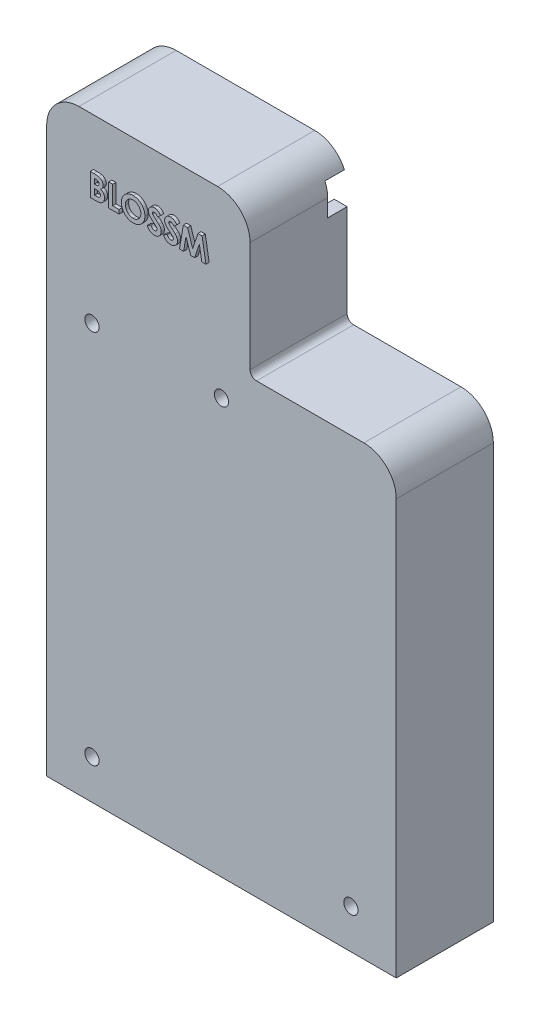
from build123d import *

# Parameters (mm, degrees)
BOSS_EXTRUDE1_DEPTH = 15
BOSS_EXTRUDE2_DEPTH = 15
CUT_EXTRUDE1_DEPTH  = 14
SKETCH8_W           = 6.699223296
SKETCH8_H           = 4.721357371
SKETCH8_W_2         = 8.228893272
CUT_EXTRUDE7_DEPTH  = 3
BOSS_EXTRUDE4_REACH = 1406.346
SKETCH10_R          = 2.1
SKETCH10_R_2        = 1.1
SKETCH11_R          = 1.1
CUT_EXTRUDE8_DEPTH  = 15
BOSS_EXTRUDE5_DEPTH = 0.5


with BuildPart() as part:
    # Sketch3 → Boss-Extrude1 (new body)
    with BuildSketch(Plane.XY.offset(1303.472903018)):
        with BuildLine():
            Line((839.650097305, 1097.589789038), (839.650097371, 1033.49652121))
            Line((839.650097371, 1033.49652121), (785.650097371, 1033.49652121))
            Line((785.650097371, 1033.49652121), (785.650097438, 1120.589789038))
            ThreePointArc((785.650097438, 1120.589789038), (787.114883847, 1124.124637961), (790.64973277, 1125.58942437))
            Line((790.64973277, 1125.58942437), (812.066461973, 1125.58942437))
            ThreePointArc((812.066461973, 1125.58942437), (815.601310896, 1124.124637961), (817.066097305, 1120.589789038))
            Line((817.066097305, 1120.589789038), (817.066097305, 1103.589789038))
            ThreePointArc((817.066097305, 1103.589789038), (817.35931084, 1102.882637905), (818.066461973, 1102.58942437))
            Line((818.066461973, 1102.58942437), (834.650461973, 1102.58942437))
            ThreePointArc((834.650461973, 1102.58942437), (838.185310896, 1101.124637961), (839.650097305, 1097.589789038))
        make_face()
        with BuildLine():
            Line((787.650097371, 1035.49652121), (787.650097371, 1120.589424436))
            ThreePointArc((787.650097371, 1120.589424436), (788.529097371, 1122.710424436), (790.650097371, 1123.589424436))
            Line((790.650097371, 1123.589424436), (812.066097371, 1123.589424436))
            ThreePointArc((812.066097371, 1123.589424436), (814.187097371, 1122.710424436), (815.066097371, 1120.589424436))
            Line((815.066097371, 1120.589424436), (815.066097371, 1103.589424436))
            ThreePointArc((815.066097371, 1103.589424436), (815.945097371, 1101.468424436), (818.066097371, 1100.589424436))
            Line((818.066097371, 1100.589424436), (834.650097371, 1100.589424436))
            ThreePointArc((834.650097371, 1100.589424436), (836.771097371, 1099.710424436), (837.650097371, 1097.589424436))
            Line((837.650097371, 1097.589424436), (837.650097371, 1035.49652121))
            Line((837.650097371, 1035.49652121), (787.650097371, 1035.49652121))
        make_face(mode=Mode.SUBTRACT)
    extrude(amount=BOSS_EXTRUDE1_DEPTH)

    # Sketch6 → Boss-Extrude2 (add)
    with BuildSketch(Plane.XY.offset(1303.472903018)):
        with BuildLine():
            Line((787.650097371, 1035.49652121), (837.650097371, 1035.49652121))
            Line((837.650097371, 1035.49652121), (837.650097371, 1097.589424436))
            ThreePointArc((837.650097371, 1097.589424436), (836.771097371, 1099.710424436), (834.650097371, 1100.589424436))
            Line((834.650097371, 1100.589424436), (818.066097371, 1100.589424436))
            ThreePointArc((818.066097371, 1100.589424436), (815.945097371, 1101.468424436), (815.066097371, 1103.589424436))
            Line((815.066097371, 1103.589424436), (815.066097371, 1120.589424436))
            ThreePointArc((815.066097371, 1120.589424436), (814.187097371, 1122.710424436), (812.066097371, 1123.589424436))
            Line((812.066097371, 1123.589424436), (790.650097371, 1123.589424436))
            ThreePointArc((790.650097371, 1123.589424436), (788.529097371, 1122.710424436), (787.650097371, 1120.589424436))
            Line((787.650097371, 1120.589424436), (787.650097371, 1035.49652121))
        make_face()
    extrude(amount=BOSS_EXTRUDE2_DEPTH)

    # Sketch6<2> → Cut-Extrude1 (cut)
    with BuildSketch(Plane.XY.offset(1303.472903018)):
        with BuildLine():
            Line((787.650097371, 1035.49652121), (837.650097371, 1035.49652121))
            Line((837.650097371, 1035.49652121), (837.650097371, 1097.589424436))
            ThreePointArc((837.650097371, 1097.589424436), (836.771097371, 1099.710424436), (834.650097371, 1100.589424436))
            Line((834.650097371, 1100.589424436), (818.066097371, 1100.589424436))
            ThreePointArc((818.066097371, 1100.589424436), (815.945097371, 1101.468424436), (815.066097371, 1103.589424436))
            Line((815.066097371, 1103.589424436), (815.066097371, 1120.589424436))
            ThreePointArc((815.066097371, 1120.589424436), (814.187097371, 1122.710424436), (812.066097371, 1123.589424436))
            Line((812.066097371, 1123.589424436), (790.650097371, 1123.589424436))
            ThreePointArc((790.650097371, 1123.589424436), (788.529097371, 1122.710424436), (787.650097371, 1120.589424436))
            Line((787.650097371, 1120.589424436), (787.650097371, 1035.49652121))
        make_face()
    extrude(amount=CUT_EXTRUDE1_DEPTH, mode=Mode.SUBTRACT)

    # Sketch8 → Cut-Extrude7 (cut)
    with BuildSketch(Plane.XY.offset(1303.472903018)):
        with Locations((788.177093813, 1120.255926572)):
            Rectangle(SKETCH8_W, SKETCH8_H)
        with Locations((813.958809837, 1120.255926572)):
            Rectangle(SKETCH8_W_2, SKETCH8_H)
    extrude(amount=CUT_EXTRUDE7_DEPTH, mode=Mode.SUBTRACT)

    # Sketch10 → Boss-Extrude4 (add, up to next)
    with BuildSketch(Plane.XY.offset(1303.472903018), mode=Mode.PRIVATE) as boss_extrude4_sk1:
        with Locations((792.650097371, 1039.589424436)):
            Circle(SKETCH10_R)
        with Locations((792.650097371, 1039.589424436)):
            Circle(SKETCH10_R_2, mode=Mode.SUBTRACT)
    boss_extrude4_tool1 = extrude(boss_extrude4_sk1.sketch, amount=BOSS_EXTRUDE4_REACH, mode=Mode.PRIVATE) - part.part
    # Sketch10 → Boss-Extrude4 (add, up to next)
    with BuildSketch(Plane.XY.offset(1303.472903018), mode=Mode.PRIVATE) as boss_extrude4_sk2:
        with Locations((832.650097371, 1039.589424436)):
            Circle(SKETCH10_R)
        with Locations((832.650097371, 1039.589424436)):
            Circle(SKETCH10_R_2, mode=Mode.SUBTRACT)
    boss_extrude4_tool2 = extrude(boss_extrude4_sk2.sketch, amount=BOSS_EXTRUDE4_REACH, mode=Mode.PRIVATE) - part.part
    # Sketch10 → Boss-Extrude4 (add, up to next)
    with BuildSketch(Plane.XY.offset(1303.472903018), mode=Mode.PRIVATE) as boss_extrude4_sk3:
        with Locations((812.650097371, 1097.589424436)):
            Circle(SKETCH10_R)
        with Locations((812.650097371, 1097.589424436)):
            Circle(SKETCH10_R_2, mode=Mode.SUBTRACT)
    boss_extrude4_tool3 = extrude(boss_extrude4_sk3.sketch, amount=BOSS_EXTRUDE4_REACH, mode=Mode.PRIVATE) - part.part
    # Sketch10 → Boss-Extrude4 (add, up to next)
    with BuildSketch(Plane.XY.offset(1303.472903018), mode=Mode.PRIVATE) as boss_extrude4_sk4:
        with Locations((792.650097371, 1097.589424436)):
            Circle(SKETCH10_R)
        with Locations((792.650097371, 1097.589424436)):
            Circle(SKETCH10_R_2, mode=Mode.SUBTRACT)
    boss_extrude4_tool4 = extrude(boss_extrude4_sk4.sketch, amount=BOSS_EXTRUDE4_REACH, mode=Mode.PRIVATE) - part.part
    add(boss_extrude4_tool1.solids().sort_by_distance((790.609494, 1039.589424, 1303.472903))[0])
    add(boss_extrude4_tool2.solids().sort_by_distance((830.609494, 1039.589424, 1303.472903))[0])
    add(boss_extrude4_tool3.solids().sort_by_distance((810.609494, 1097.589424, 1303.472903))[0])
    add(boss_extrude4_tool4.solids().sort_by_distance((790.609494, 1097.589424, 1303.472903))[0])

    # Sketch11 → Cut-Extrude8 (cut)
    with BuildSketch(Plane.XY.offset(1303.472903018)):
        with Locations((792.650097371, 1097.589424436)):
            Circle(SKETCH11_R)
        with Locations((812.650097371, 1097.589424436)):
            Circle(SKETCH11_R)
        with Locations((792.650097371, 1039.589424436)):
            Circle(SKETCH11_R)
        with Locations((832.650097371, 1039.589424436)):
            Circle(SKETCH11_R)
    extrude(amount=CUT_EXTRUDE8_DEPTH, mode=Mode.SUBTRACT)

    # Sketch12 → Boss-Extrude5 (add)
    # profile 1 of 12: a face of its own
    with BuildSketch(Plane.XY.offset(1318.472903018)):
        with BuildLine():
            Line((0.448717949, 3.5), (1.131610577, 3.5))
            add(Edge.make_bspline(
                [(1.131610577, 3.5), (1.165039055, 3.49982425), (1.229831765, 3.499483602), (1.324051207, 3.49420047), (1.412300018, 3.486996801), (1.49460379, 3.475566708), (1.570924493, 3.461774931), (1.64149213, 3.445073115), (1.706082302, 3.425046501), (1.783195039, 3.39320022), (1.871115699, 3.345877051), (1.966314092, 3.275948486), (2.047718332, 3.190416023), (2.117904649, 3.093933368), (2.173705768, 2.987797596), (2.214075066, 2.874538407), (2.239632941, 2.755616665), (2.242261375, 2.673973487), (2.243589744, 2.63271234)],
                knots=[0, 0, 0, 0, 1.001505555, 1.941167018, 2.826882275, 3.653841531, 4.429895133, 5.150066043, 5.825578002, 6.45369114, 7.647487171, 8.808567382, 9.977351308, 11.170798116, 12.373658725, 13.556498008, 14.765093433, 16, 16, 16, 16], degree=3))
            add(Edge.make_bspline(
                [(2.243589744, 2.63271234), (2.242496525, 2.594059784), (2.240348248, 2.518103867), (2.219805488, 2.407009758), (2.18764482, 2.301258539), (2.142939571, 2.201236154), (2.084837575, 2.10920254), (2.015979256, 2.024415274), (1.932902454, 1.950464217), (1.870659214, 1.909121315), (1.839042468, 1.888120994)],
                knots=[0, 0, 0, 0, 1.044552857, 2.05264487, 3.044412934, 4.028983338, 5.005914585, 5.980388656, 6.974128949, 8, 8, 8, 8], degree=3))
            add(Edge.make_bspline(
                [(1.839042468, 1.888120994), (1.878802896, 1.872855995), (1.954874443, 1.84365027), (2.059560455, 1.792014806), (2.1497553, 1.735852696), (2.226152446, 1.674520846), (2.291490101, 1.608412035), (2.348543043, 1.536556921), (2.397224417, 1.458018163), (2.438937341, 1.373614627), (2.471486097, 1.284208159), (2.495862001, 1.190637383), (2.50982945, 1.093237828), (2.511817091, 1.026952448), (2.512820513, 0.993489583)],
                knots=[0, 0, 0, 0, 1.27268992, 2.434971085, 3.483601985, 4.442670788, 5.356604649, 6.2567628, 7.179492994, 8.113709626, 9.066344395, 10.018646069, 10.999752585, 12, 12, 12, 12], degree=3))
            add(Edge.make_bspline(
                [(2.512820513, 0.993489583), (2.511843667, 0.959322711), (2.509921695, 0.892098433), (2.495741723, 0.793343299), (2.471732616, 0.698968352), (2.43866147, 0.608363169), (2.395499155, 0.521703035), (2.342971191, 0.438889771), (2.280339627, 0.36075544), (2.210276758, 0.286431817), (2.131014613, 0.21960403), (2.045498858, 0.160088323), (1.952652538, 0.111142261), (1.854000544, 0.070026239), (1.748436228, 0.038619041), (1.63643362, 0.016646467), (1.518089319, 0.00184143), (1.436879567, 0.000624225), (1.395232372, 0)],
                knots=[0, 0, 0, 0, 0.978564426, 1.925352924, 2.850884081, 3.763762016, 4.682927383, 5.618979971, 6.567305752, 7.547517671, 8.540179244, 9.531824382, 10.526200242, 11.540722885, 12.589160233, 13.674978461, 14.80764778, 16, 16, 16, 16], degree=3))
            Line((1.395232372, 0), (0.448717949, 0))
            Line((0.448717949, 0), (0.448717949, 3.5))
        make_face()
        with BuildLine():
            Line((0.762820513, 3.141025641), (0.762820513, 2.019230769))
            Line((0.762820513, 2.019230769), (0.973858173, 2.019230769))
            add(Edge.make_bspline(
                [(0.973858173, 2.019230769), (1.004706968, 2.019630692), (1.064313128, 2.020403425), (1.150633024, 2.022616942), (1.230758042, 2.028814985), (1.304549876, 2.035011248), (1.371892319, 2.045085835), (1.432636181, 2.057077958), (1.487734778, 2.069760863), (1.551274323, 2.09133035), (1.623347272, 2.123208025), (1.700180376, 2.172679861), (1.767914846, 2.231604215), (1.825112033, 2.299595176), (1.871923504, 2.374461362), (1.904437219, 2.455008243), (1.926484503, 2.539228375), (1.928476035, 2.597046627), (1.929487179, 2.626402244)],
                knots=[0, 0, 0, 0, 1.156816544, 2.235205308, 3.236616184, 4.169592532, 5.011045266, 5.787822928, 6.49130361, 7.128639758, 8.301311294, 9.436451833, 10.541879658, 11.654887649, 12.756523258, 13.837046038, 14.901820046, 16, 16, 16, 16], degree=3))
            add(Edge.make_bspline(
                [(1.929487179, 2.626402244), (1.928960999, 2.645828015), (1.927928839, 2.683933787), (1.919475537, 2.739483141), (1.905107962, 2.791726894), (1.886653669, 2.841381004), (1.86086498, 2.886892854), (1.830501517, 2.92983605), (1.793815827, 2.968748169), (1.752058514, 3.005117667), (1.704049891, 3.037362195), (1.649818599, 3.065602958), (1.588630922, 3.088343735), (1.521518067, 3.108259887), (1.44744698, 3.122248181), (1.367272427, 3.133901569), (1.280337708, 3.139834311), (1.220192605, 3.140619673), (1.189102564, 3.141025641)],
                knots=[0, 0, 0, 0, 0.91205012, 1.789085906, 2.630437955, 3.453916878, 4.269457761, 5.079663411, 5.91843418, 6.774407191, 7.675494373, 8.627863946, 9.638891023, 10.736472738, 11.911756761, 13.175263542, 14.539845004, 16, 16, 16, 16], degree=3))
            Line((1.189102564, 3.141025641), (0.762820513, 3.141025641))
        make_face(mode=Mode.SUBTRACT)
        with BuildLine():
            Line((0.762820513, 1.66025641), (0.762820513, 0.358974359))
            Line((0.762820513, 0.358974359), (1.210136218, 0.358974359))
            add(Edge.make_bspline(
                [(1.210136218, 0.358974359), (1.242155144, 0.359358106), (1.303867402, 0.360097729), (1.392968633, 0.362512283), (1.475551736, 0.368004559), (1.551239872, 0.376650409), (1.620850325, 0.386028858), (1.683548028, 0.398640139), (1.739841221, 0.413089099), (1.805115529, 0.435423272), (1.878619037, 0.470119743), (1.957829894, 0.522433969), (2.028256112, 0.584757277), (2.088061371, 0.656888191), (2.13707436, 0.735319518), (2.172729815, 0.818464868), (2.194720671, 0.904950395), (2.197382841, 0.963917108), (2.198717949, 0.993489583)],
                knots=[0, 0, 0, 0, 1.160039823, 2.235823828, 3.228722157, 4.157150951, 4.99529583, 5.772374946, 6.472645482, 7.099169577, 8.269452708, 9.405989375, 10.527446681, 11.663510218, 12.788923519, 13.866172445, 14.929861265, 16, 16, 16, 16], degree=3))
            add(Edge.make_bspline(
                [(2.198717949, 0.993489583), (2.198441844, 1.011982924), (2.197894089, 1.048671306), (2.189633474, 1.102587125), (2.177619605, 1.154812998), (2.162088171, 1.205490739), (2.139468704, 1.253704115), (2.113062159, 1.300406674), (2.082100757, 1.345660154), (2.033856591, 1.402872407), (1.963684607, 1.46878942), (1.863977831, 1.533326923), (1.750605533, 1.58537473), (1.66837804, 1.607474206), (1.625901442, 1.618890224)],
                knots=[0, 0, 0, 0, 0.723448775, 1.435228256, 2.130040452, 2.821711965, 3.505591119, 4.210454504, 4.921174351, 5.648778258, 7.137944449, 8.670945889, 10.280296675, 12, 12, 12, 12], degree=3))
            add(Edge.make_bspline(
                [(1.625901442, 1.618890224), (1.608872346, 1.622345308), (1.571949754, 1.629836643), (1.511742174, 1.637744346), (1.443006305, 1.644789406), (1.365583428, 1.650000564), (1.279375586, 1.655387107), (1.184198668, 1.657481929), (1.080441353, 1.659981189), (1.008448981, 1.660162323), (0.971053686, 1.66025641)],
                knots=[0, 0, 0, 0, 0.634451884, 1.375622551, 2.216452059, 3.157844607, 4.20941857, 5.370758133, 6.634282058, 8, 8, 8, 8], degree=3))
            Line((0.971053686, 1.66025641), (0.762820513, 1.66025641))
        make_face(mode=Mode.SUBTRACT)
    # profile 2 of 12: a face of its own
    with BuildSketch(Plane.XY.offset(1318.472903018)):
        Polygon((3.230769231, 3.5), (3.544871795, 3.5), (3.544871795, 0.358974359), (4.891025641, 0.358974359), (4.891025641, 0), (3.230769231, 0), align=None)
    # profile 3 of 12: a face of its own
    with BuildSketch(Plane.XY.offset(1318.472903018)):
        with BuildLine():
            add(Edge.make_bspline(
                [(7.112179487, 3.58974359), (7.176987593, 3.58810211), (7.30427606, 3.584878109), (7.491350958, 3.560199006), (7.669946053, 3.517503616), (7.841516192, 3.460640633), (8.004009168, 3.384786248), (8.158648061, 3.2931011), (8.305064935, 3.184624641), (8.441286316, 3.060195414), (8.565943267, 2.92481196), (8.675769153, 2.78033405), (8.767811447, 2.627635248), (8.843397234, 2.467174417), (8.902695843, 2.299314449), (8.943614887, 2.123160446), (8.969753037, 1.939853756), (8.972808815, 1.814826892), (8.974358974, 1.751402244)],
                knots=[0, 0, 0, 0, 1.065120563, 2.091984664, 3.0946048, 4.079830382, 5.057816894, 6.036188127, 7.030412546, 8.04752943, 9.064399622, 10.05169764, 11.02544977, 11.989514704, 12.962713494, 13.945757189, 14.957906945, 16, 16, 16, 16], degree=3))
            add(Edge.make_bspline(
                [(8.974358974, 1.751402244), (8.972809042, 1.688444797), (8.969753945, 1.564348377), (8.943585168, 1.382204933), (8.902544168, 1.207114236), (8.843947902, 1.039368583), (8.768722423, 0.87879102), (8.676067252, 0.725804066), (8.566926041, 0.580357567), (8.44271919, 0.444044902), (8.307318148, 0.319047431), (8.162087881, 0.210128556), (8.010294561, 0.116404431), (7.849984853, 0.041620757), (7.683284816, -0.018151163), (7.508702493, -0.058903793), (7.327055939, -0.085190837), (7.203184936, -0.088209353), (7.140224359, -0.08974359)],
                knots=[0, 0, 0, 0, 1.043624062, 2.057103931, 3.04512605, 4.022047818, 4.998200453, 5.980619268, 6.982898556, 8.009068085, 9.034988726, 10.034168286, 11.015286542, 11.987931943, 12.962482838, 13.94673481, 14.956375938, 16, 16, 16, 16], degree=3))
            add(Edge.make_bspline(
                [(7.140224359, -0.08974359), (7.07680004, -0.088194203), (6.951773824, -0.085139949), (6.768236789, -0.058958544), (6.591959045, -0.01801724), (6.423444694, 0.040492196), (6.262599764, 0.116109427), (6.109109681, 0.208313806), (5.963590534, 0.317720947), (5.827248788, 0.441887521), (5.702499589, 0.577059073), (5.593740214, 0.721893329), (5.5015151, 0.873548785), (5.426151768, 1.032446309), (5.366487309, 1.197817752), (5.32578249, 1.370766229), (5.299446538, 1.550305735), (5.296411692, 1.672548634), (5.294871795, 1.734575321)],
                knots=[0, 0, 0, 0, 1.053102029, 2.075944431, 3.073151272, 4.055350789, 5.033113405, 6.020478099, 7.024410459, 8.052272461, 9.079885166, 10.07527673, 11.055994387, 12.023226415, 12.992069828, 13.970394897, 14.97016774, 16, 16, 16, 16], degree=3))
            add(Edge.make_bspline(
                [(5.294871795, 1.734575321), (5.29540643, 1.77620799), (5.296468957, 1.858948113), (5.309260649, 1.981814713), (5.32782235, 2.102705371), (5.354424263, 2.221276319), (5.38921593, 2.337237304), (5.430267957, 2.451388067), (5.480407803, 2.56257179), (5.537088451, 2.671315182), (5.600350259, 2.775923088), (5.670226008, 2.874802671), (5.744261377, 2.968783668), (5.82542477, 3.055430672), (5.911041215, 3.137264328), (6.002499594, 3.213027045), (6.099241838, 3.283401996), (6.201684218, 3.346822337), (6.307302493, 3.404181472), (6.41617927, 3.453403323), (6.526835842, 3.495649384), (6.63979049, 3.529890209), (6.754743262, 3.556922245), (6.871945046, 3.575329599), (6.991302473, 3.588153917), (7.071713792, 3.589211419), (7.112179487, 3.58974359)],
                knots=[0, 0, 0, 0, 1.037015668, 2.060948919, 3.074880161, 4.083647147, 5.086022904, 6.090072063, 7.104153813, 8.122640571, 9.144368836, 10.147691507, 11.138137339, 12.123020368, 13.103399296, 14.087645067, 15.080126199, 16.082011238, 17.087798457, 18.072939717, 19.057185487, 20.037253025, 21.01195951, 21.997135196, 22.992090687, 24, 24, 24, 24], degree=3))
        make_face()
        with BuildLine():
            add(Edge.make_bspline(
                [(7.127604167, 3.230769231), (7.094389533, 3.230364341), (7.0282778, 3.229558431), (6.929993264, 3.218942715), (6.83300133, 3.203812826), (6.737281968, 3.182231305), (6.643235679, 3.152827253), (6.549985837, 3.118986345), (6.458382784, 3.077765254), (6.368728926, 3.03119255), (6.281813851, 2.979643629), (6.199801149, 2.922671862), (6.122478505, 2.861613307), (6.050035238, 2.79632547), (5.982684066, 2.726475868), (5.919099365, 2.653123432), (5.861829783, 2.574171541), (5.809344206, 2.491761134), (5.762376366, 2.405999553), (5.720611011, 2.317789691), (5.686447003, 2.226412004), (5.658584626, 2.132857846), (5.635484815, 2.037275387), (5.620850891, 1.938939538), (5.610118532, 1.838344426), (5.609358686, 1.770362572), (5.608974359, 1.735977564)],
                knots=[0, 0, 0, 0, 1.008559885, 2.007477868, 2.99961109, 3.989939068, 4.984837346, 5.991145699, 7.001802488, 8.033829008, 9.059044045, 10.069351652, 11.065060232, 12.050310815, 13.029377138, 14.011219647, 14.996725999, 15.989392538, 16.977580475, 17.965360261, 18.951710183, 19.937753436, 20.929683414, 21.935841486, 22.955955122, 24, 24, 24, 24], degree=3))
            add(Edge.make_bspline(
                [(5.608974359, 1.735977564), (5.610249221, 1.685415343), (5.612757269, 1.585943813), (5.634714839, 1.440175669), (5.668536813, 1.300087383), (5.71839418, 1.166445474), (5.780744794, 1.038101191), (5.857771685, 0.916193086), (5.94903077, 0.800688212), (6.052694297, 0.692392943), (6.166017004, 0.593547138), (6.286349733, 0.50678373), (6.412403341, 0.43337348), (6.544506544, 0.373568408), (6.681954083, 0.32617867), (6.825631634, 0.293700039), (6.974582093, 0.272324583), (7.076112748, 0.270271827), (7.127604167, 0.269230769)],
                knots=[0, 0, 0, 0, 1.032063989, 2.030389145, 3.003944642, 3.970395727, 4.937377036, 5.913328081, 6.909231446, 7.93887556, 8.970685674, 9.976071282, 10.964166581, 11.944589148, 12.933237628, 13.927779006, 14.949070134, 16, 16, 16, 16], degree=3))
            add(Edge.make_bspline(
                [(7.127604167, 0.269230769), (7.162213668, 0.269706274), (7.230854705, 0.270649342), (7.332950227, 0.280148018), (7.433206439, 0.295379888), (7.531482719, 0.317310543), (7.62766753, 0.34475775), (7.722162333, 0.377365478), (7.813960623, 0.418046682), (7.904220461, 0.462994633), (7.990616703, 0.514234791), (8.073092235, 0.56927294), (8.149568215, 0.630241561), (8.221957286, 0.694559374), (8.289584975, 0.763523221), (8.35199396, 0.837043443), (8.408974092, 0.9155841), (8.461439738, 0.997869506), (8.508243001, 1.083865759), (8.5490221, 1.172395437), (8.583618216, 1.263240546), (8.611546721, 1.356532118), (8.633432183, 1.452092966), (8.648512103, 1.550051045), (8.659060541, 1.650210387), (8.659855618, 1.717954243), (8.66025641, 1.752103365)],
                knots=[0, 0, 0, 0, 1.047197238, 2.076906641, 3.100256066, 4.114471768, 5.12198147, 6.126382909, 7.136867548, 8.15857795, 9.17633901, 10.174870724, 11.156907918, 12.133735059, 13.104061851, 14.077631395, 15.04955518, 16.038496417, 17.029181396, 18.010275684, 18.986308667, 19.968651475, 20.955262928, 21.950658345, 22.966943676, 24, 24, 24, 24], degree=3))
            add(Edge.make_bspline(
                [(8.66025641, 1.752103365), (8.659855297, 1.78601887), (8.659059616, 1.85329652), (8.648517141, 1.952757338), (8.633416251, 2.05001055), (8.611653543, 2.144674353), (8.583603389, 2.236772878), (8.549016059, 2.326219625), (8.508230759, 2.413347821), (8.461422535, 2.497942118), (8.408806711, 2.579116855), (8.351312468, 2.656719268), (8.28794712, 2.729292009), (8.220521095, 2.798626703), (8.14735021, 2.863244593), (8.068765916, 2.923167114), (7.985722238, 2.979840388), (7.897795002, 3.03096595), (7.807051049, 3.078180182), (7.713937091, 3.118631186), (7.619507991, 3.153003305), (7.524003879, 3.18232027), (7.4266209, 3.2037283), (7.328017072, 3.21895635), (7.228328813, 3.229554736), (7.161285593, 3.230363114), (7.127604167, 3.230769231)],
                knots=[0, 0, 0, 0, 1.02996197, 2.043119294, 3.035359645, 4.018872909, 4.991431989, 5.957985074, 6.929999688, 7.912076566, 8.892894881, 9.867085534, 10.843653904, 11.817741046, 12.803660682, 13.806313499, 14.818574707, 15.856120519, 16.894564902, 17.924820532, 18.937903209, 19.946497019, 20.957711757, 21.963978472, 22.977135795, 24, 24, 24, 24], degree=3))
        make_face(mode=Mode.SUBTRACT)
    # profile 4 of 12: a face of its own
    with BuildSketch(Plane.XY.offset(1318.472903018)):
        with BuildLine():
            Line((9.333333333, 0.675180288), (9.629206731, 0.852564103))
            add(Edge.make_bspline(
                [(9.629206731, 0.852564103), (9.656724968, 0.806499718), (9.709448849, 0.718242134), (9.797400208, 0.598984093), (9.888533119, 0.497621937), (9.983522453, 0.414745329), (10.081788401, 0.349496442), (10.183972454, 0.303294211), (10.289730265, 0.274478235), (10.361704087, 0.270978149), (10.397636218, 0.269230769)],
                knots=[0, 0, 0, 0, 1.272034388, 2.437168799, 3.508375237, 4.49857839, 5.41946034, 6.295179144, 7.148887113, 8, 8, 8, 8], degree=3))
            add(Edge.make_bspline(
                [(10.397636218, 0.269230769), (10.428323078, 0.270085442), (10.489159852, 0.271779832), (10.578722094, 0.288060634), (10.665703897, 0.313072763), (10.748312534, 0.348893694), (10.825408149, 0.39223218), (10.893014844, 0.444578358), (10.951460958, 0.503184563), (10.999270072, 0.568567218), (11.035950107, 0.638884367), (11.064142176, 0.711060318), (11.079787249, 0.786228886), (11.082144003, 0.836839349), (11.083333333, 0.862379808)],
                knots=[0, 0, 0, 0, 1.095163259, 2.171163733, 3.241058638, 4.321873601, 5.38011039, 6.391990106, 7.366004449, 8.327778327, 9.272591725, 10.192022065, 11.087607919, 12, 12, 12, 12], degree=3))
            add(Edge.make_bspline(
                [(11.083333333, 0.862379808), (11.081859023, 0.891520657), (11.078861964, 0.950759747), (11.053530484, 1.0381594), (11.013681238, 1.12465197), (10.976918594, 1.178153235), (10.957832532, 1.205929487)],
                knots=[0, 0, 0, 0, 0.938893495, 1.908633276, 2.914225137, 4, 4, 4, 4], degree=3))
            add(Edge.make_bspline(
                [(10.957832532, 1.205929487), (10.942161918, 1.225976311), (10.909263424, 1.268062109), (10.852705911, 1.330707345), (10.786339797, 1.395325764), (10.712436242, 1.464384821), (10.628303153, 1.534672617), (10.536575639, 1.609540895), (10.43491178, 1.686142472), (10.363612283, 1.737515038), (10.326822917, 1.764022436)],
                knots=[0, 0, 0, 0, 0.722233717, 1.516239348, 2.393582979, 3.351407094, 4.387010283, 5.505090956, 6.712668013, 8, 8, 8, 8], degree=3))
            add(Edge.make_bspline(
                [(10.326822917, 1.764022436), (10.28999892, 1.790251024), (10.219594244, 1.840398086), (10.121135662, 1.91482237), (10.033091199, 1.982866239), (9.955852182, 2.045170251), (9.889452585, 2.101742856), (9.833369174, 2.152040795), (9.789030617, 2.197424356), (9.764375036, 2.226865698), (9.753305288, 2.240084135)],
                knots=[0, 0, 0, 0, 1.452282411, 2.77665338, 3.964542531, 5.026858415, 5.96415736, 6.766646006, 7.446254459, 8, 8, 8, 8], degree=3))
            add(Edge.make_bspline(
                [(9.753305288, 2.240084135), (9.737832743, 2.260685171), (9.707403907, 2.301199875), (9.667237901, 2.364524733), (9.633098738, 2.429347998), (9.606336406, 2.495843863), (9.583800187, 2.563078792), (9.568642257, 2.631930038), (9.55915086, 2.702088656), (9.558178873, 2.749302157), (9.557692308, 2.772936699)],
                knots=[0, 0, 0, 0, 1.068054152, 2.10047183, 3.106115577, 4.101338837, 5.06977816, 6.043150881, 7.020423561, 8, 8, 8, 8], degree=3))
            add(Edge.make_bspline(
                [(9.557692308, 2.772936699), (9.558997517, 2.809966473), (9.561580037, 2.883234537), (9.583420554, 2.990265367), (9.617893448, 3.092451785), (9.666188336, 3.188782118), (9.728445688, 3.276748099), (9.800491663, 3.357361586), (9.886303149, 3.425130168), (9.980455772, 3.484342227), (10.083512144, 3.530688152), (10.191503048, 3.565649132), (10.30460012, 3.58545839), (10.381203254, 3.588301155), (10.420072115, 3.58974359)],
                knots=[0, 0, 0, 0, 1.005424448, 1.989358655, 2.955360095, 3.929531133, 4.905563448, 5.876582895, 6.856512386, 7.866279853, 8.892233794, 9.918561126, 10.94386622, 12, 12, 12, 12], degree=3))
            add(Edge.make_bspline(
                [(10.420072115, 3.58974359), (10.461316216, 3.588321038), (10.543337567, 3.585492037), (10.663986783, 3.560894506), (10.780147499, 3.520193834), (10.873590764, 3.474005176), (10.946723526, 3.42787376), (11.002496258, 3.385853936), (11.059013709, 3.337478827), (11.116731764, 3.282619581), (11.174672423, 3.22077283), (11.233695876, 3.152362141), (11.293940144, 3.077805585), (11.332696005, 3.024581085), (11.352564103, 2.997295673)],
                knots=[0, 0, 0, 0, 1.286793592, 2.559021753, 3.825965368, 5.121522368, 5.803751409, 6.523245864, 7.299691795, 8.125521123, 9.008227632, 9.944561021, 10.946284179, 12, 12, 12, 12], degree=3))
            Line((11.352564103, 2.997295673), (11.068609776, 2.782051282))
            add(Edge.make_bspline(
                [(11.068609776, 2.782051282), (11.051463843, 2.804139972), (11.018444786, 2.846677626), (10.968315299, 2.906248941), (10.921066651, 2.960665421), (10.874516252, 3.007930549), (10.83112262, 3.050632682), (10.789005578, 3.087192439), (10.748771227, 3.117968034), (10.698054316, 3.150811594), (10.634336598, 3.183368098), (10.554352061, 3.210917176), (10.470765786, 3.227472238), (10.413836155, 3.229661126), (10.385016026, 3.230769231)],
                knots=[0, 0, 0, 0, 1.181633172, 2.275549214, 3.290209073, 4.226197932, 5.078386478, 5.862611352, 6.581680152, 7.217281963, 8.414376989, 9.595101626, 10.782541182, 12, 12, 12, 12], degree=3))
            add(Edge.make_bspline(
                [(10.385016026, 3.230769231), (10.348859503, 3.229557531), (10.279135056, 3.227220882), (10.18014482, 3.201700896), (10.091050895, 3.161519036), (10.01449833, 3.105204058), (9.950761353, 3.038483065), (9.904655894, 2.96170421), (9.876905729, 2.876921808), (9.87351945, 2.817780151), (9.871794872, 2.787660256)],
                knots=[0, 0, 0, 0, 1.14458467, 2.207223713, 3.21896685, 4.227309161, 5.202851033, 6.127160689, 7.046193047, 8, 8, 8, 8], degree=3))
            add(Edge.make_bspline(
                [(9.871794872, 2.787660256), (9.872187998, 2.768908778), (9.872974895, 2.731375158), (9.883949692, 2.675923736), (9.898049021, 2.620612397), (9.920391653, 2.565689814), (9.951236957, 2.510195455), (9.991742132, 2.453173718), (10.042755445, 2.394122009), (10.081832457, 2.355714635), (10.102463942, 2.335436699)],
                knots=[0, 0, 0, 0, 0.858281714, 1.717966888, 2.583508476, 3.4729293, 4.427298488, 5.488583878, 6.674047936, 8, 8, 8, 8], degree=3))
            add(Edge.make_bspline(
                [(10.102463942, 2.335436699), (10.110125315, 2.328599673), (10.128326982, 2.312356465), (10.161602908, 2.285764184), (10.205545706, 2.252961412), (10.259007907, 2.212374095), (10.322975269, 2.165292633), (10.397454825, 2.112319021), (10.481616358, 2.051733562), (10.541338274, 2.009376021), (10.572916667, 1.986979167)],
                knots=[0, 0, 0, 0, 0.420754252, 0.999615792, 1.744751191, 2.668019286, 3.750313428, 4.999500688, 6.413464383, 8, 8, 8, 8], degree=3))
            add(Edge.make_bspline(
                [(10.572916667, 1.986979167), (10.61090258, 1.959337807), (10.684457036, 1.905814145), (10.789114616, 1.825398465), (10.884008424, 1.746750697), (10.969471628, 1.67037309), (11.046348536, 1.596844997), (11.113786257, 1.525281816), (11.172471937, 1.456196244), (11.235651156, 1.367623668), (11.300208975, 1.258842584), (11.355650483, 1.125564345), (11.39060883, 0.991768025), (11.395180346, 0.901841188), (11.397435897, 0.857471955)],
                knots=[0, 0, 0, 0, 1.163667725, 2.253281268, 3.268753668, 4.215851969, 5.092017293, 5.902905408, 6.650798638, 7.335211899, 8.59617414, 9.77448103, 10.901945474, 12, 12, 12, 12], degree=3))
            add(Edge.make_bspline(
                [(11.397435897, 0.857471955), (11.396778759, 0.82609359), (11.395477244, 0.763946206), (11.38051633, 0.67269113), (11.358596665, 0.58406026), (11.325559431, 0.499149147), (11.285236273, 0.416404385), (11.234070025, 0.337996484), (11.17476234, 0.262190086), (11.106728576, 0.191006594), (11.032282673, 0.125660398), (10.953598979, 0.067531337), (10.870548706, 0.019063014), (10.783582389, -0.020487828), (10.692680052, -0.051421346), (10.597872268, -0.073834215), (10.499002757, -0.087589926), (10.431802276, -0.089017687), (10.397636218, -0.08974359)],
                knots=[0, 0, 0, 0, 0.983748083, 1.948392443, 2.894712957, 3.844097841, 4.80183111, 5.778335162, 6.776009319, 7.81870978, 8.863265674, 9.881300176, 10.883814829, 11.87499822, 12.874611388, 13.892143829, 14.928324115, 16, 16, 16, 16], degree=3))
            add(Edge.make_bspline(
                [(10.397636218, -0.08974359), (10.371200875, -0.089232408), (10.318663115, -0.088216483), (10.240953633, -0.079235202), (10.164814044, -0.066528099), (10.091199762, -0.046354029), (10.01916235, -0.021877052), (9.949015116, 0.008261281), (9.880724062, 0.044378482), (9.813906479, 0.085673507), (9.748732304, 0.133731252), (9.685812836, 0.189704748), (9.623083651, 0.252050253), (9.562396255, 0.322460816), (9.50252311, 0.399798899), (9.444644701, 0.484788083), (9.387562983, 0.576965436), (9.351747515, 0.641830522), (9.333333333, 0.675180288)],
                knots=[0, 0, 0, 0, 0.915332311, 1.819136955, 2.706846663, 3.586547465, 4.459518054, 5.340707479, 6.227863349, 7.133153174, 8.059268498, 9.028702269, 10.047606654, 11.120612155, 12.245963614, 13.433783089, 14.680604001, 16, 16, 16, 16], degree=3))
        make_face()
    # profile 5 of 12: a face of its own
    with BuildSketch(Plane.XY.offset(1318.472903018)):
        with BuildLine():
            Line((11.756410256, 0.675180288), (12.052283654, 0.852564103))
            add(Edge.make_bspline(
                [(12.052283654, 0.852564103), (12.079801891, 0.806499718), (12.132525772, 0.718242134), (12.220477131, 0.598984093), (12.311610042, 0.497621937), (12.406599376, 0.414745329), (12.504865324, 0.349496442), (12.607049377, 0.303294211), (12.712807188, 0.274478235), (12.78478101, 0.270978149), (12.820713141, 0.269230769)],
                knots=[0, 0, 0, 0, 1.272034388, 2.437168799, 3.508375237, 4.49857839, 5.41946034, 6.295179144, 7.148887113, 8, 8, 8, 8], degree=3))
            add(Edge.make_bspline(
                [(12.820713141, 0.269230769), (12.851400002, 0.270085442), (12.912236775, 0.271779832), (13.001799018, 0.288060634), (13.08878082, 0.313072763), (13.171389458, 0.348893694), (13.248485072, 0.39223218), (13.316091767, 0.444578358), (13.374537881, 0.503184563), (13.422346995, 0.568567218), (13.45902703, 0.638884367), (13.487219099, 0.711060318), (13.502864173, 0.786228886), (13.505220926, 0.836839349), (13.506410256, 0.862379808)],
                knots=[0, 0, 0, 0, 1.095163259, 2.171163733, 3.241058638, 4.321873601, 5.38011039, 6.391990106, 7.366004449, 8.327778327, 9.272591725, 10.192022065, 11.087607919, 12, 12, 12, 12], degree=3))
            add(Edge.make_bspline(
                [(13.506410256, 0.862379808), (13.504935946, 0.891520657), (13.501938887, 0.950759747), (13.476607407, 1.0381594), (13.436758161, 1.12465197), (13.399995517, 1.178153235), (13.380909455, 1.205929487)],
                knots=[0, 0, 0, 0, 0.938893495, 1.908633276, 2.914225137, 4, 4, 4, 4], degree=3))
            add(Edge.make_bspline(
                [(13.380909455, 1.205929487), (13.365238841, 1.225976311), (13.332340347, 1.268062109), (13.275782834, 1.330707345), (13.20941672, 1.395325764), (13.135513165, 1.464384821), (13.051380076, 1.534672617), (12.959652562, 1.609540895), (12.857988703, 1.686142472), (12.786689206, 1.737515038), (12.74989984, 1.764022436)],
                knots=[0, 0, 0, 0, 0.722233717, 1.516239348, 2.393582979, 3.351407094, 4.387010283, 5.505090956, 6.712668013, 8, 8, 8, 8], degree=3))
            add(Edge.make_bspline(
                [(12.74989984, 1.764022436), (12.713075844, 1.790251024), (12.642671167, 1.840398086), (12.544212585, 1.91482237), (12.456168122, 1.982866239), (12.378929105, 2.045170251), (12.312529508, 2.101742856), (12.256446097, 2.152040795), (12.21210754, 2.197424356), (12.187451959, 2.226865698), (12.176382212, 2.240084135)],
                knots=[0, 0, 0, 0, 1.452282411, 2.77665338, 3.964542531, 5.026858415, 5.96415736, 6.766646006, 7.446254459, 8, 8, 8, 8], degree=3))
            add(Edge.make_bspline(
                [(12.176382212, 2.240084135), (12.160909666, 2.260685171), (12.13048083, 2.301199875), (12.090314824, 2.364524733), (12.056175661, 2.429347998), (12.029413329, 2.495843863), (12.00687711, 2.563078792), (11.99171918, 2.631930038), (11.982227783, 2.702088656), (11.981255796, 2.749302157), (11.980769231, 2.772936699)],
                knots=[0, 0, 0, 0, 1.068054152, 2.10047183, 3.106115577, 4.101338837, 5.06977816, 6.043150881, 7.020423561, 8, 8, 8, 8], degree=3))
            add(Edge.make_bspline(
                [(11.980769231, 2.772936699), (11.98207444, 2.809966473), (11.98465696, 2.883234537), (12.006497477, 2.990265367), (12.040970371, 3.092451785), (12.089265259, 3.188782118), (12.151522612, 3.276748099), (12.223568586, 3.357361586), (12.309380072, 3.425130168), (12.403532695, 3.484342227), (12.506589067, 3.530688152), (12.614579971, 3.565649132), (12.727677043, 3.58545839), (12.804280178, 3.588301155), (12.843149038, 3.58974359)],
                knots=[0, 0, 0, 0, 1.005424448, 1.989358655, 2.955360095, 3.929531133, 4.905563448, 5.876582895, 6.856512386, 7.866279853, 8.892233794, 9.918561126, 10.94386622, 12, 12, 12, 12], degree=3))
            add(Edge.make_bspline(
                [(12.843149038, 3.58974359), (12.884393139, 3.588321038), (12.966414491, 3.585492037), (13.087063706, 3.560894506), (13.203224422, 3.520193834), (13.296667687, 3.474005176), (13.369800449, 3.42787376), (13.425573181, 3.385853936), (13.482090632, 3.337478827), (13.539808687, 3.282619581), (13.597749347, 3.22077283), (13.656772799, 3.152362141), (13.717017068, 3.077805585), (13.755772928, 3.024581085), (13.775641026, 2.997295673)],
                knots=[0, 0, 0, 0, 1.286793592, 2.559021753, 3.825965368, 5.121522368, 5.803751409, 6.523245864, 7.299691795, 8.125521123, 9.008227632, 9.944561021, 10.946284179, 12, 12, 12, 12], degree=3))
            Line((13.775641026, 2.997295673), (13.491686699, 2.782051282))
            add(Edge.make_bspline(
                [(13.491686699, 2.782051282), (13.474540766, 2.804139972), (13.441521709, 2.846677626), (13.391392222, 2.906248941), (13.344143574, 2.960665421), (13.297593175, 3.007930549), (13.254199543, 3.050632682), (13.212082501, 3.087192439), (13.17184815, 3.117968034), (13.121131239, 3.150811594), (13.057413521, 3.183368098), (12.977428984, 3.210917176), (12.893842709, 3.227472238), (12.836913078, 3.229661126), (12.808092949, 3.230769231)],
                knots=[0, 0, 0, 0, 1.181633172, 2.275549214, 3.290209073, 4.226197932, 5.078386478, 5.862611352, 6.581680152, 7.217281963, 8.414376989, 9.595101626, 10.782541182, 12, 12, 12, 12], degree=3))
            add(Edge.make_bspline(
                [(12.808092949, 3.230769231), (12.771936426, 3.229557531), (12.702211979, 3.227220882), (12.603221743, 3.201700896), (12.514127818, 3.161519036), (12.437575253, 3.105204058), (12.373838276, 3.038483065), (12.327732817, 2.96170421), (12.299982652, 2.876921808), (12.296596373, 2.817780151), (12.294871795, 2.787660256)],
                knots=[0, 0, 0, 0, 1.14458467, 2.207223713, 3.21896685, 4.227309161, 5.202851033, 6.127160689, 7.046193047, 8, 8, 8, 8], degree=3))
            add(Edge.make_bspline(
                [(12.294871795, 2.787660256), (12.295264922, 2.768908778), (12.296051818, 2.731375158), (12.307026615, 2.675923736), (12.321125944, 2.620612397), (12.343468576, 2.565689814), (12.37431388, 2.510195455), (12.414819056, 2.453173718), (12.465832368, 2.394122009), (12.50490938, 2.355714635), (12.525540865, 2.335436699)],
                knots=[0, 0, 0, 0, 0.858281714, 1.717966888, 2.583508476, 3.4729293, 4.427298488, 5.488583878, 6.674047936, 8, 8, 8, 8], degree=3))
            add(Edge.make_bspline(
                [(12.525540865, 2.335436699), (12.533202238, 2.328599673), (12.551403905, 2.312356465), (12.584679831, 2.285764184), (12.628622629, 2.252961412), (12.68208483, 2.212374095), (12.746052192, 2.165292633), (12.820531748, 2.112319021), (12.904693281, 2.051733562), (12.964415197, 2.009376021), (12.99599359, 1.986979167)],
                knots=[0, 0, 0, 0, 0.420754252, 0.999615792, 1.744751191, 2.668019286, 3.750313428, 4.999500688, 6.413464383, 8, 8, 8, 8], degree=3))
            add(Edge.make_bspline(
                [(12.99599359, 1.986979167), (13.033979503, 1.959337807), (13.107533959, 1.905814145), (13.212191539, 1.825398465), (13.307085347, 1.746750697), (13.392548551, 1.67037309), (13.469425459, 1.596844997), (13.53686318, 1.525281816), (13.59554886, 1.456196244), (13.658728079, 1.367623668), (13.723285898, 1.258842584), (13.778727406, 1.125564345), (13.813685753, 0.991768025), (13.818257269, 0.901841188), (13.820512821, 0.857471955)],
                knots=[0, 0, 0, 0, 1.163667725, 2.253281268, 3.268753668, 4.215851969, 5.092017293, 5.902905408, 6.650798638, 7.335211899, 8.59617414, 9.77448103, 10.901945474, 12, 12, 12, 12], degree=3))
            add(Edge.make_bspline(
                [(13.820512821, 0.857471955), (13.819855682, 0.82609359), (13.818554167, 0.763946206), (13.803593254, 0.67269113), (13.781673588, 0.58406026), (13.748636354, 0.499149147), (13.708313196, 0.416404385), (13.657146948, 0.337996484), (13.597839264, 0.262190086), (13.529805499, 0.191006594), (13.455359596, 0.125660398), (13.376675902, 0.067531337), (13.293625629, 0.019063014), (13.206659312, -0.020487828), (13.115756975, -0.051421346), (13.020949192, -0.073834215), (12.92207968, -0.087589926), (12.854879199, -0.089017687), (12.820713141, -0.08974359)],
                knots=[0, 0, 0, 0, 0.983748083, 1.948392443, 2.894712957, 3.844097841, 4.80183111, 5.778335162, 6.776009319, 7.81870978, 8.863265674, 9.881300176, 10.883814829, 11.87499822, 12.874611388, 13.892143829, 14.928324115, 16, 16, 16, 16], degree=3))
            add(Edge.make_bspline(
                [(12.820713141, -0.08974359), (12.794277798, -0.089232408), (12.741740038, -0.088216483), (12.664030556, -0.079235202), (12.587890967, -0.066528099), (12.514276685, -0.046354029), (12.442239273, -0.021877052), (12.372092039, 0.008261281), (12.303800985, 0.044378482), (12.236983402, 0.085673507), (12.171809227, 0.133731252), (12.108889759, 0.189704748), (12.046160574, 0.252050253), (11.985473178, 0.322460816), (11.925600033, 0.399798899), (11.867721624, 0.484788083), (11.810639906, 0.576965436), (11.774824438, 0.641830522), (11.756410256, 0.675180288)],
                knots=[0, 0, 0, 0, 0.915332311, 1.819136955, 2.706846663, 3.586547465, 4.459518054, 5.340707479, 6.227863349, 7.133153174, 8.059268498, 9.028702269, 10.047606654, 11.120612155, 12.245963614, 13.433783089, 14.680604001, 16, 16, 16, 16], degree=3))
        make_face()
    # profile 6 of 12: a face of its own
    with BuildSketch(Plane.XY.offset(1318.472903018)):
        Polygon((14.358974359, 0), (14.821013622, 3.5), (14.865885417, 3.5), (16.310897436, 0.628205128), (17.751702724, 3.5), (17.796574519, 3.5), (18.262820513, 0), (17.948717949, 0), (17.612179487, 2.516326122), (16.349459135, 0), (16.277944712, 0), (15.009615385, 2.524038462), (14.675180288, 0), align=None)
    # profile 7 of 12: a face of its own
    with BuildSketch(Plane.XY.offset(1318.472903018)):
        with BuildLine():
            Line((792.889826531, 1114.778898332), (792.889826531, 1118.278898332))
            Line((792.889826531, 1118.278898332), (793.450723967, 1118.278898332))
            add(Edge.make_bspline(
                [(793.450723967, 1118.278898332), (793.489990294, 1118.278902813), (793.565969894, 1118.278911484), (793.675588627, 1118.275062034), (793.777250745, 1118.27008234), (793.870632718, 1118.264511219), (793.95589349, 1118.254911065), (794.032903408, 1118.244793552), (794.101816338, 1118.232592454), (794.144421458, 1118.221647691), (794.164465954, 1118.216498492)],
                knots=[0, 0, 0, 0, 1.311965854, 2.538629056, 3.664479157, 4.713267157, 5.663616078, 6.530575999, 7.308677837, 8, 8, 8, 8], degree=3))
            add(Edge.make_bspline(
                [(794.164465954, 1118.216498492), (794.190786412, 1118.209235455), (794.242435601, 1118.194983044), (794.316413722, 1118.166199685), (794.38659229, 1118.13420494), (794.452885617, 1118.09770492), (794.514886637, 1118.056258968), (794.572359724, 1118.009538156), (794.626544431, 1117.959417855), (794.675516783, 1117.904501226), (794.719779721, 1117.846471636), (794.758236277, 1117.785344288), (794.791650096, 1117.722053861), (794.818389903, 1117.655803886), (794.838537846, 1117.586899462), (794.853273966, 1117.515634822), (794.862824968, 1117.441784467), (794.863727413, 1117.391541656), (794.864185505, 1117.366037755)],
                knots=[0, 0, 0, 0, 1.099996261, 2.158545794, 3.195537121, 4.207578794, 5.205712374, 6.197378256, 7.190519799, 8.17788031, 9.159561366, 10.129234751, 11.085776129, 12.040971148, 13.00380137, 13.975669004, 14.972423361, 16, 16, 16, 16], degree=3))
            add(Edge.make_bspline(
                [(794.864185505, 1117.366037755), (794.862987729, 1117.333271936), (794.860630055, 1117.268776447), (794.845569071, 1117.174044243), (794.817327379, 1117.084508693), (794.780373812, 1116.998519693), (794.730128514, 1116.91639798), (794.666326703, 1116.838182603), (794.59000176, 1116.761465191), (794.531456315, 1116.715478278), (794.501004415, 1116.691558588)],
                knots=[0, 0, 0, 0, 0.986156485, 1.941127874, 2.875419072, 3.804401753, 4.751181392, 5.761612777, 6.835722519, 8, 8, 8, 8], degree=3))
            add(Edge.make_bspline(
                [(794.501004415, 1116.691558588), (794.525681174, 1116.678961317), (794.57406547, 1116.654261553), (794.642756957, 1116.613662515), (794.706357775, 1116.570480289), (794.765153092, 1116.525583719), (794.817909608, 1116.477069573), (794.866805728, 1116.427733305), (794.909429173, 1116.37474815), (794.947544342, 1116.320002601), (794.980673427, 1116.262703936), (795.009525207, 1116.202948918), (795.03389527, 1116.140533413), (795.054532471, 1116.075775065), (795.0699237, 1116.008451134), (795.079959109, 1115.938537544), (795.087642845, 1115.866272735), (795.088240568, 1115.817047751), (795.08854448, 1115.792019326)],
                knots=[0, 0, 0, 0, 1.164658916, 2.283573913, 3.35186032, 4.395461096, 5.390182219, 6.362969632, 7.312859996, 8.245001507, 9.165155236, 10.092416118, 11.032087915, 11.979892451, 12.947605196, 13.931445124, 14.948243989, 16, 16, 16, 16], degree=3))
            add(Edge.make_bspline(
                [(795.08854448, 1115.792019326), (795.086572295, 1115.744216463), (795.082680197, 1115.649877706), (795.054223076, 1115.511366745), (795.004887471, 1115.380045791), (794.938639927, 1115.256436769), (794.857010206, 1115.144117958), (794.763159435, 1115.045727655), (794.658032477, 1114.962442448), (794.561040153, 1114.906231394), (794.47714943, 1114.868508521), (794.407664312, 1114.845185862), (794.333038767, 1114.823579785), (794.251905837, 1114.808407552), (794.165736348, 1114.794520257), (794.073690145, 1114.785945952), (793.975939259, 1114.780135358), (793.908799725, 1114.77931901), (793.874201531, 1114.778898332)],
                knots=[0, 0, 0, 0, 1.284142165, 2.534249414, 3.780121997, 5.041676246, 6.291546858, 7.49970053, 8.684500223, 9.883330709, 10.50184324, 11.153274765, 11.851151195, 12.587658647, 13.369265475, 14.195992086, 15.070362669, 16, 16, 16, 16], degree=3))
            Line((793.874201531, 1114.778898332), (792.889826531, 1114.778898332))
        make_face()
        with BuildLine():
            Line((793.518031659, 1117.650693204), (793.518031659, 1116.887872691))
            Line((793.518031659, 1116.887872691), (793.684898646, 1116.887872691))
            add(Edge.make_bspline(
                [(793.684898646, 1116.887872691), (793.707577369, 1116.888070458), (793.751357271, 1116.888452235), (793.814592695, 1116.893369394), (793.873391428, 1116.901758373), (793.927530457, 1116.913463109), (793.977514109, 1116.928326418), (794.023023073, 1116.946210178), (794.063857254, 1116.96803031), (794.111297128, 1117.000532359), (794.161444496, 1117.04836058), (794.205588659, 1117.117458354), (794.231589277, 1117.196920532), (794.234485045, 1117.252963413), (794.235980377, 1117.28190314)],
                knots=[0, 0, 0, 0, 1.065314748, 2.056525647, 2.977365736, 3.853934255, 4.656397591, 5.425096493, 6.14721249, 6.826394842, 8.123232004, 9.372140726, 10.643011755, 12, 12, 12, 12], degree=3))
            add(Edge.make_bspline(
                [(794.235980377, 1117.28190314), (794.234783837, 1117.309010002), (794.232470376, 1117.361420032), (794.206291097, 1117.435008381), (794.165629501, 1117.500222719), (794.117622772, 1117.5448566), (794.072415108, 1117.575340225), (794.033705532, 1117.595412394), (793.991218865, 1117.613380795), (793.944132612, 1117.627119872), (793.89271566, 1117.637429191), (793.837217771, 1117.645000152), (793.777543191, 1117.65015327), (793.736325831, 1117.650509365), (793.715046883, 1117.650693204)],
                knots=[0, 0, 0, 0, 1.347982417, 2.606269829, 3.849316587, 5.153353503, 5.842674298, 6.568177932, 7.326619318, 8.142485038, 9.012069166, 9.942760135, 10.937925643, 12, 12, 12, 12], degree=3))
            Line((793.715046883, 1117.650693204), (793.518031659, 1117.650693204))
        make_face(mode=Mode.SUBTRACT)
        with BuildLine():
            Line((793.518031659, 1116.304539358), (793.518031659, 1115.40710346))
            Line((793.518031659, 1115.40710346), (793.698921082, 1115.40710346))
            add(Edge.make_bspline(
                [(793.698921082, 1115.40710346), (793.734683151, 1115.407307768), (793.803440192, 1115.407700574), (793.901934531, 1115.41244661), (793.991490509, 1115.421000503), (794.071870836, 1115.431679349), (794.143198629, 1115.446147516), (794.205232785, 1115.464541935), (794.258824021, 1115.484779001), (794.303651, 1115.509774179), (794.340272075, 1115.538862369), (794.373318755, 1115.568591197), (794.400262959, 1115.602886209), (794.421581716, 1115.640275215), (794.440033062, 1115.679829446), (794.451161611, 1115.723093479), (794.459634498, 1115.768785072), (794.460100784, 1115.800388959), (794.460339351, 1115.816558588)],
                knots=[0, 0, 0, 0, 1.753078804, 3.370512758, 4.83203934, 6.162291463, 7.344201807, 8.395507345, 9.331626367, 10.147333109, 10.898971645, 11.62040215, 12.321813352, 13.025280112, 13.727906689, 14.453419512, 15.208716525, 16, 16, 16, 16], degree=3))
            add(Edge.make_bspline(
                [(794.460339351, 1115.816558588), (794.459813241, 1115.835048814), (794.45878852, 1115.8710628), (794.45041961, 1115.923701083), (794.435210567, 1115.972842413), (794.416054034, 1116.0197434), (794.389396702, 1116.062724824), (794.357715374, 1116.103274112), (794.319436241, 1116.140018137), (794.276389124, 1116.175179317), (794.226178923, 1116.205964834), (794.168782082, 1116.232676724), (794.103886789, 1116.254985511), (794.031292026, 1116.272747781), (793.951316041, 1116.287822374), (793.863375097, 1116.296823571), (793.768201599, 1116.303518156), (793.702206745, 1116.304191222), (793.668071723, 1116.304539358)],
                knots=[0, 0, 0, 0, 0.845221588, 1.646264278, 2.427170338, 3.19324141, 3.95557735, 4.731569926, 5.540061037, 6.376114724, 7.268642756, 8.224665384, 9.265483498, 10.400594375, 11.639216012, 12.983232105, 14.439614077, 16, 16, 16, 16], degree=3))
            Line((793.668071723, 1116.304539358), (793.518031659, 1116.304539358))
        make_face(mode=Mode.SUBTRACT)
    # profile 8 of 12: a face of its own
    with BuildSketch(Plane.XY.offset(1318.472903018)):
        Polygon((795.716749608, 1118.278898332), (796.344954736, 1118.278898332), (796.344954736, 1115.40710346), (797.332134223, 1115.40710346), (797.332134223, 1114.778898332), (795.716749608, 1114.778898332), align=None)
    # profile 9 of 12: a face of its own
    with BuildSketch(Plane.XY.offset(1318.472903018)):
        with BuildLine():
            add(Edge.make_bspline(
                [(799.515427492, 1118.368641922), (799.576279282, 1118.36706636), (799.696414497, 1118.363955844), (799.873090046, 1118.338027267), (800.043349605, 1118.295780367), (800.207116182, 1118.237054121), (800.363979726, 1118.160257924), (800.514493546, 1118.067568997), (800.658118509, 1117.957237893), (800.793382861, 1117.831838455), (800.918391518, 1117.695472042), (801.026711592, 1117.548649353), (801.119082978, 1117.395174714), (801.195640629, 1117.234636883), (801.253953531, 1117.065924061), (801.294874105, 1116.889896458), (801.321163547, 1116.706604154), (801.324187238, 1116.581807078), (801.325723967, 1116.518381505)],
                knots=[0, 0, 0, 0, 1.014329547, 2.002516266, 2.970391464, 3.935626869, 4.897733899, 5.877609409, 6.878433252, 7.912639331, 8.949961323, 9.958554974, 10.949718813, 11.932905612, 12.9188844, 13.919928257, 14.942845884, 16, 16, 16, 16], degree=3))
            add(Edge.make_bspline(
                [(801.325723967, 1116.518381505), (801.324087417, 1116.455670592), (801.320862543, 1116.332096725), (801.295947355, 1116.150493531), (801.254337673, 1115.976351551), (801.197013804, 1115.80927661), (801.121844619, 1115.650077961), (801.031274576, 1115.497739144), (800.922913704, 1115.353673898), (800.80071435, 1115.217959535), (800.666183465, 1115.09476963), (800.523693902, 1114.986208739), (800.373903589, 1114.894218336), (800.217031771, 1114.818840559), (800.052742045, 1114.760342642), (799.881440225, 1114.71906811), (799.703136913, 1114.693984744), (799.581882013, 1114.690780935), (799.520335345, 1114.689154742)],
                knots=[0, 0, 0, 0, 1.051557043, 2.072126891, 3.067553643, 4.050577992, 5.02905126, 6.015227836, 7.017913613, 8.04756643, 9.074058332, 10.072836633, 11.047628519, 12.017157415, 12.98668631, 13.966869689, 14.968021931, 16, 16, 16, 16], degree=3))
            add(Edge.make_bspline(
                [(799.520335345, 1114.689154742), (799.45596491, 1114.690613517), (799.329485803, 1114.69347981), (799.144383064, 1114.720736949), (798.967038646, 1114.761795723), (798.798942344, 1114.82307374), (798.638382241, 1114.899676413), (798.486538019, 1114.994017198), (798.343460708, 1115.10594019), (798.209971022, 1115.232578998), (798.089029044, 1115.37114963), (797.982274025, 1115.517537214), (797.892223799, 1115.670623479), (797.81887507, 1115.830480071), (797.761049878, 1115.996113521), (797.720260776, 1116.168532584), (797.696165679, 1116.347323737), (797.692809372, 1116.468762262), (797.691108582, 1116.530300576)],
                knots=[0, 0, 0, 0, 1.067978421, 2.098431617, 3.099715153, 4.085208694, 5.062210972, 6.048429807, 7.046490867, 8.072918869, 9.098532598, 10.095778865, 11.076610158, 12.041847152, 13.011192615, 13.984257998, 14.978533688, 16, 16, 16, 16], degree=3))
            add(Edge.make_bspline(
                [(797.691108582, 1116.530300576), (797.691642388, 1116.571700331), (797.692703241, 1116.653975626), (797.70548233, 1116.775903414), (797.723880544, 1116.895451335), (797.75109063, 1117.01214275), (797.784143929, 1117.126800862), (797.826969148, 1117.238358406), (797.875715837, 1117.348007124), (797.932671752, 1117.454451925), (797.996001224, 1117.556713429), (798.065099315, 1117.654309252), (798.140139773, 1117.746059315), (798.220880867, 1117.832566564), (798.307600843, 1117.91326238), (798.399158987, 1117.989289125), (798.497330996, 1118.058627257), (798.599968192, 1118.122970152), (798.70649193, 1118.181154317), (798.816468562, 1118.230678937), (798.927632352, 1118.273927945), (799.041468298, 1118.308061974), (799.156756446, 1118.335863784), (799.274728416, 1118.354249597), (799.394318398, 1118.367028333), (799.474961989, 1118.368102782), (799.515427492, 1118.368641922)],
                knots=[0, 0, 0, 0, 1.034744296, 2.056386356, 3.06226378, 4.057406941, 5.050368692, 6.043467995, 7.042652155, 8.049140477, 9.059438543, 10.048523776, 11.036952808, 12.020949711, 13.004946614, 13.997082645, 14.994316842, 16.007702937, 17.024872941, 18.026463647, 19.021641123, 20.005082605, 20.995858141, 21.984425357, 22.988620895, 24, 24, 24, 24], degree=3))
        make_face()
        with BuildLine():
            add(Edge.make_bspline(
                [(799.505611787, 1117.740436794), (799.464658541, 1117.739337926), (799.383833221, 1117.737169201), (799.265277196, 1117.720646451), (799.151459225, 1117.694257742), (799.043010246, 1117.656034019), (798.939460233, 1117.60738492), (798.840625622, 1117.548480432), (798.747875069, 1117.477295779), (798.659971834, 1117.397652547), (798.580565727, 1117.308911684), (798.510407926, 1117.213810757), (798.451697147, 1117.112508583), (798.402526501, 1117.005946236), (798.365511903, 1116.89292545), (798.339147514, 1116.774331529), (798.322486205, 1116.64996013), (798.320386026, 1116.565176309), (798.31931371, 1116.521887114)],
                knots=[0, 0, 0, 0, 1.033739768, 2.040188636, 3.016340934, 3.979330865, 4.937572243, 5.900995986, 6.878200029, 7.884839167, 8.891893314, 9.879764717, 10.863503415, 11.843163062, 12.837761627, 13.859916423, 14.907309254, 16, 16, 16, 16], degree=3))
            add(Edge.make_bspline(
                [(798.31931371, 1116.521887114), (798.320735438, 1116.473912948), (798.323521788, 1116.37989153), (798.343126885, 1116.24273562), (798.376669255, 1116.113205476), (798.425103785, 1115.99193461), (798.485175309, 1115.8775764), (798.559774609, 1115.771532468), (798.647693528, 1115.673167874), (798.71542555, 1115.615738527), (798.749802492, 1115.58659064)],
                knots=[0, 0, 0, 0, 1.078454662, 2.113592447, 3.107694534, 4.079536787, 5.043276885, 6.005368276, 6.987637804, 8, 8, 8, 8], degree=3))
            add(Edge.make_bspline(
                [(798.749802492, 1115.58659064), (798.777963771, 1115.5650573), (798.83365185, 1115.522475771), (798.922542147, 1115.467898806), (799.014081651, 1115.421120903), (799.10896114, 1115.38332491), (799.206980235, 1115.353595218), (799.308125493, 1115.332776003), (799.412253602, 1115.319710145), (799.482669908, 1115.318148528), (799.51823198, 1115.31735987)],
                knots=[0, 0, 0, 0, 1.023928204, 2.024787132, 3.009472467, 3.9914905, 4.972207045, 5.96565515, 6.972602802, 8, 8, 8, 8], degree=3))
            add(Edge.make_bspline(
                [(799.51823198, 1115.31735987), (799.558481034, 1115.318468055), (799.637672314, 1115.320648443), (799.754021354, 1115.336967789), (799.865487269, 1115.364586014), (799.972762048, 1115.402474425), (800.075536358, 1115.451734355), (800.173307913, 1115.512465876), (800.266248134, 1115.583923281), (800.354039381, 1115.664612403), (800.43428473, 1115.753702844), (800.504296126, 1115.84931103), (800.564873615, 1115.949330425), (800.613021756, 1116.055176654), (800.651498717, 1116.165850577), (800.677545797, 1116.281842344), (800.694347856, 1116.402673795), (800.696448627, 1116.484903867), (800.697518838, 1116.526794967)],
                knots=[0, 0, 0, 0, 1.026359118, 2.019393844, 2.989460624, 3.950973911, 4.916101784, 5.890408035, 6.881132271, 7.902007068, 8.92769091, 9.933912415, 10.920395702, 11.90457117, 12.894218921, 13.903490204, 14.931958862, 16, 16, 16, 16], degree=3))
            add(Edge.make_bspline(
                [(800.697518838, 1116.526794967), (800.696411597, 1116.56844518), (800.694232162, 1116.650427274), (800.677884093, 1116.770948068), (800.650441016, 1116.886427766), (800.61243883, 1116.997054959), (800.56391205, 1117.102938103), (800.503903765, 1117.203704849), (800.432624535, 1117.299257781), (800.351714847, 1117.388945742), (800.263649625, 1117.471363233), (800.169102809, 1117.542886634), (800.070719927, 1117.605038195), (799.966243593, 1117.653725218), (799.857811308, 1117.692514066), (799.744761411, 1117.721078731), (799.626665718, 1117.737053128), (799.546322777, 1117.739298851), (799.505611787, 1117.740436794)],
                knots=[0, 0, 0, 0, 1.055025985, 2.07665775, 3.074803781, 4.057872707, 5.035505728, 6.020516407, 7.023567878, 8.050795229, 9.077271434, 10.074415901, 11.050397877, 12.019801805, 12.988065821, 13.964604439, 14.968634123, 16, 16, 16, 16], degree=3))
        make_face(mode=Mode.SUBTRACT)
    # profile 10 of 12: a face of its own
    with BuildSketch(Plane.XY.offset(1318.472903018)):
        with BuildLine():
            Line((803.74880089, 1117.811250095), (803.279049287, 1117.381462435))
            add(Edge.make_bspline(
                [(803.279049287, 1117.381462435), (803.258927143, 1117.409846811), (803.220295432, 1117.464340856), (803.157677457, 1117.537309666), (803.095342235, 1117.599557492), (803.032712268, 1117.65082429), (802.969232426, 1117.690798576), (802.905012902, 1117.719100813), (802.840417775, 1117.737092813), (802.79701982, 1117.73933325), (802.775643838, 1117.740436794)],
                knots=[0, 0, 0, 0, 1.299362458, 2.494594718, 3.587462134, 4.587049575, 5.512617175, 6.380583204, 7.202344345, 8, 8, 8, 8], degree=3))
            add(Edge.make_bspline(
                [(802.775643838, 1117.740436794), (802.755704936, 1117.739737538), (802.717208154, 1117.738387458), (802.662328134, 1117.724967769), (802.613604872, 1117.701807357), (802.571085917, 1117.671523169), (802.537404633, 1117.635037744), (802.510512738, 1117.596773915), (802.495370342, 1117.5545393), (802.493377305, 1117.525530864), (802.492390633, 1117.511169967)],
                knots=[0, 0, 0, 0, 1.185010067, 2.2879431, 3.333075148, 4.379039566, 5.372662701, 6.27520591, 7.14612461, 8, 8, 8, 8], degree=3))
            add(Edge.make_bspline(
                [(802.492390633, 1117.511169967), (802.49300893, 1117.496601979), (802.494254095, 1117.467264077), (802.506280689, 1117.424265727), (802.5244082, 1117.382251334), (802.541729777, 1117.356675174), (802.550583742, 1117.343601858)],
                knots=[0, 0, 0, 0, 0.967525499, 1.948461899, 2.951351359, 4, 4, 4, 4], degree=3))
            add(Edge.make_bspline(
                [(802.550583742, 1117.343601858), (802.558632955, 1117.333440106), (802.577161179, 1117.310049096), (802.612490708, 1117.273001381), (802.656857177, 1117.227614689), (802.711967901, 1117.175449733), (802.775535081, 1117.114630458), (802.85050514, 1117.047547693), (802.934720112, 1116.972123963), (802.994578162, 1116.919601608), (803.025944319, 1116.892079422)],
                knots=[0, 0, 0, 0, 0.473873513, 1.090794244, 1.870441696, 2.795289791, 3.865433203, 5.087734844, 6.473946851, 8, 8, 8, 8], degree=3))
            add(Edge.make_bspline(
                [(803.025944319, 1116.892079422), (803.05538597, 1116.866599158), (803.111260106, 1116.818242912), (803.190757905, 1116.749608984), (803.260623231, 1116.687860713), (803.321873861, 1116.633924808), (803.373581296, 1116.587235358), (803.415962913, 1116.547569187), (803.449536333, 1116.515698523), (803.468620857, 1116.496448623), (803.476765633, 1116.488233268)],
                knots=[0, 0, 0, 0, 1.543621617, 2.929473131, 4.163658386, 5.240097082, 6.164993805, 6.925417477, 7.541396219, 8, 8, 8, 8], degree=3))
            add(Edge.make_bspline(
                [(803.476765633, 1116.488233268), (803.507665218, 1116.4547933), (803.567065071, 1116.390509937), (803.644263939, 1116.290890943), (803.707801106, 1116.193642491), (803.756954662, 1116.096934695), (803.794077405, 1115.999372254), (803.820249431, 1115.898562454), (803.835924031, 1115.793451896), (803.837664278, 1115.721726771), (803.83854448, 1115.685448813)],
                knots=[0, 0, 0, 0, 1.206664779, 2.319633467, 3.337109185, 4.282041471, 5.190008762, 6.099243693, 7.03861361, 8, 8, 8, 8], degree=3))
            add(Edge.make_bspline(
                [(803.83854448, 1115.685448813), (803.837917974, 1115.650100391), (803.836688748, 1115.580745473), (803.82163308, 1115.47925488), (803.800164582, 1115.382123979), (803.766970517, 1115.290409689), (803.726513787, 1115.20260655), (803.675795434, 1115.120082255), (803.616233682, 1115.042001624), (803.547966769, 1114.969760444), (803.472455457, 1114.90420658), (803.391462399, 1114.845848982), (803.304195603, 1114.797667352), (803.211400663, 1114.757993216), (803.113127251, 1114.727435666), (803.009492439, 1114.704850789), (802.900337711, 1114.691295701), (802.825696135, 1114.689878678), (802.787562909, 1114.689154742)],
                knots=[0, 0, 0, 0, 1.043214005, 2.046824704, 3.02475056, 3.976699089, 4.921714032, 5.875962561, 6.831408892, 7.817874052, 8.806269674, 9.781291748, 10.760897367, 11.74438705, 12.757449933, 13.795994037, 14.874007457, 16, 16, 16, 16], degree=3))
            add(Edge.make_bspline(
                [(802.787562909, 1114.689154742), (802.757628651, 1114.689685796), (802.698341654, 1114.690737587), (802.610961582, 1114.699324583), (802.526586245, 1114.713183082), (802.445310684, 1114.733046452), (802.366768739, 1114.758216034), (802.290957183, 1114.788959715), (802.218399369, 1114.82575401), (802.14854629, 1114.867842282), (802.081737518, 1114.916712309), (802.017128284, 1114.971364961), (801.955360346, 1115.032640819), (801.896137046, 1115.100394968), (801.839837311, 1115.174819272), (801.784618249, 1115.254877234), (801.732933961, 1115.342054622), (801.701006278, 1115.403210265), (801.684698326, 1115.43444721)],
                knots=[0, 0, 0, 0, 1.016823716, 2.013894106, 2.979844003, 3.91962641, 4.853723003, 5.779685073, 6.695824784, 7.614987388, 8.547259901, 9.504950863, 10.487499108, 11.500346958, 12.559593716, 13.656357062, 14.802919212, 16, 16, 16, 16], degree=3))
            Line((801.684698326, 1115.43444721), (802.2371823, 1115.766077819))
            add(Edge.make_bspline(
                [(802.2371823, 1115.766077819), (802.257581111, 1115.730619805), (802.296687374, 1115.662643762), (802.362956593, 1115.571309333), (802.430846025, 1115.493096514), (802.501925213, 1115.42938772), (802.57532986, 1115.379331083), (802.651414527, 1115.343557137), (802.730232671, 1115.321413106), (802.78392001, 1115.318708808), (802.810699928, 1115.31735987)],
                knots=[0, 0, 0, 0, 1.283663364, 2.460892379, 3.537111102, 4.529833553, 5.449777664, 6.316464042, 7.160231139, 8, 8, 8, 8], degree=3))
            add(Edge.make_bspline(
                [(802.810699928, 1115.31735987), (802.837938939, 1115.318461486), (802.890786588, 1115.320598781), (802.966219843, 1115.340340328), (803.035379908, 1115.371336005), (803.095161357, 1115.415562562), (803.145780519, 1115.466606731), (803.183140366, 1115.523395703), (803.206610074, 1115.58484), (803.209091391, 1115.62752325), (803.210339351, 1115.648990479)],
                knots=[0, 0, 0, 0, 1.13588714, 2.203786484, 3.234766741, 4.283437687, 5.291419208, 6.222934724, 7.106237994, 8, 8, 8, 8], degree=3))
            add(Edge.make_bspline(
                [(803.210339351, 1115.648990479), (803.209186911, 1115.668962243), (803.206845839, 1115.709532968), (803.189602223, 1115.769855112), (803.162645192, 1115.830149824), (803.130753123, 1115.879605177), (803.09829895, 1115.921012804), (803.06726544, 1115.956890639), (803.029474834, 1115.996529366), (802.985022953, 1116.039978848), (802.934497122, 1116.08762158), (802.877854779, 1116.139452898), (802.81444731, 1116.19501623), (802.769630786, 1116.232865422), (802.746196723, 1116.252656345)],
                knots=[0, 0, 0, 0, 0.916159276, 1.861089862, 2.860218735, 3.940849679, 4.552606315, 5.27541173, 6.11797699, 7.06649574, 8.129236253, 9.306560635, 10.591630461, 12, 12, 12, 12], degree=3))
            add(Edge.make_bspline(
                [(802.746196723, 1116.252656345), (802.701647637, 1116.290349144), (802.616144456, 1116.362693034), (802.495317613, 1116.469542682), (802.38644181, 1116.569403469), (802.290457413, 1116.663509892), (802.206141434, 1116.750124023), (802.134064896, 1116.829949377), (802.075019594, 1116.903601696), (802.012887146, 1116.990837938), (801.953848897, 1117.097141294), (801.902823096, 1117.225036554), (801.869719711, 1117.352915587), (801.866010937, 1117.438766526), (801.864185505, 1117.481021729)],
                knots=[0, 0, 0, 0, 1.345494975, 2.582412109, 3.71882943, 4.751509156, 5.681369928, 6.505683931, 7.230279997, 7.856715994, 8.973648664, 10.023341002, 11.027102913, 12, 12, 12, 12], degree=3))
            add(Edge.make_bspline(
                [(801.864185505, 1117.481021729), (801.8649447, 1117.510986852), (801.866440394, 1117.570021362), (801.879782222, 1117.656823007), (801.899722091, 1117.740579301), (801.928680506, 1117.820984663), (801.966265031, 1117.897938383), (802.011909978, 1117.97181718), (802.066324125, 1118.041941091), (802.127645195, 1118.108263629), (802.195205314, 1118.168874881), (802.267401887, 1118.222370384), (802.343826275, 1118.267553464), (802.424010952, 1118.30503611), (802.50845279, 1118.333726694), (802.596529708, 1118.35406401), (802.688368038, 1118.366159997), (802.750834487, 1118.367804306), (802.782655056, 1118.368641922)],
                knots=[0, 0, 0, 0, 1.010766082, 1.991317756, 2.957454644, 3.913069143, 4.869106762, 5.843196583, 6.838735724, 7.860187025, 8.887984031, 9.89767229, 10.887916223, 11.879572884, 12.879850636, 13.892031539, 14.926195476, 16, 16, 16, 16], degree=3))
            add(Edge.make_bspline(
                [(802.782655056, 1118.368641922), (802.823892939, 1118.367133352), (802.906043187, 1118.364128121), (803.027504698, 1118.340628196), (803.146143223, 1118.303672088), (803.24174437, 1118.25908861), (803.317812419, 1118.215900574), (803.376111472, 1118.176138471), (803.435433897, 1118.130588844), (803.496258092, 1118.079108156), (803.557453849, 1118.020726441), (803.620761256, 1117.956833524), (803.685317673, 1117.886877219), (803.727269108, 1117.836900759), (803.74880089, 1117.811250095)],
                knots=[0, 0, 0, 0, 1.282922637, 2.555718331, 3.837320111, 5.142675274, 5.830281639, 6.55870424, 7.337177975, 8.157850921, 9.037902056, 9.96903443, 10.957596896, 12, 12, 12, 12], degree=3))
        make_face()
    # profile 11 of 12: a face of its own
    with BuildSketch(Plane.XY.offset(1318.472903018)):
        with BuildLine():
            Line((806.261621403, 1117.811250095), (805.7918698, 1117.381462435))
            add(Edge.make_bspline(
                [(805.7918698, 1117.381462435), (805.771747656, 1117.409846811), (805.733115944, 1117.464340856), (805.67049797, 1117.537309666), (805.608162748, 1117.599557492), (805.54553278, 1117.65082429), (805.482052939, 1117.690798576), (805.417833415, 1117.719100813), (805.353238287, 1117.737092813), (805.309840333, 1117.73933325), (805.288464351, 1117.740436794)],
                knots=[0, 0, 0, 0, 1.299362458, 2.494594718, 3.587462134, 4.587049575, 5.512617175, 6.380583204, 7.202344345, 8, 8, 8, 8], degree=3))
            add(Edge.make_bspline(
                [(805.288464351, 1117.740436794), (805.268525449, 1117.739737538), (805.230028666, 1117.738387458), (805.175148647, 1117.724967769), (805.126425385, 1117.701807357), (805.08390643, 1117.671523169), (805.050225145, 1117.635037744), (805.023333251, 1117.596773915), (805.008190855, 1117.5545393), (805.006197818, 1117.525530864), (805.005211146, 1117.511169967)],
                knots=[0, 0, 0, 0, 1.185010067, 2.2879431, 3.333075148, 4.379039566, 5.372662701, 6.27520591, 7.14612461, 8, 8, 8, 8], degree=3))
            add(Edge.make_bspline(
                [(805.005211146, 1117.511169967), (805.005829443, 1117.496601979), (805.007074608, 1117.467264077), (805.019101202, 1117.424265727), (805.037228713, 1117.382251334), (805.054550289, 1117.356675174), (805.063404255, 1117.343601858)],
                knots=[0, 0, 0, 0, 0.967525499, 1.948461899, 2.951351359, 4, 4, 4, 4], degree=3))
            add(Edge.make_bspline(
                [(805.063404255, 1117.343601858), (805.071453468, 1117.333440106), (805.089981692, 1117.310049096), (805.125311221, 1117.273001381), (805.16967769, 1117.227614689), (805.224788414, 1117.175449733), (805.288355594, 1117.114630458), (805.363325653, 1117.047547693), (805.447540624, 1116.972123963), (805.507398675, 1116.919601608), (805.538764832, 1116.892079422)],
                knots=[0, 0, 0, 0, 0.473873513, 1.090794244, 1.870441696, 2.795289791, 3.865433203, 5.087734844, 6.473946851, 8, 8, 8, 8], degree=3))
            add(Edge.make_bspline(
                [(805.538764832, 1116.892079422), (805.568206483, 1116.866599158), (805.624080618, 1116.818242912), (805.703578418, 1116.749608984), (805.773443744, 1116.687860713), (805.834694374, 1116.633924808), (805.886401809, 1116.587235358), (805.928783426, 1116.547569187), (805.962356846, 1116.515698523), (805.98144137, 1116.496448623), (805.989586146, 1116.488233268)],
                knots=[0, 0, 0, 0, 1.543621617, 2.929473131, 4.163658386, 5.240097082, 6.164993805, 6.925417477, 7.541396219, 8, 8, 8, 8], degree=3))
            add(Edge.make_bspline(
                [(805.989586146, 1116.488233268), (806.020485731, 1116.4547933), (806.079885583, 1116.390509937), (806.157084452, 1116.290890943), (806.220621618, 1116.193642491), (806.269775175, 1116.096934695), (806.306897918, 1115.999372254), (806.333069944, 1115.898562454), (806.348744544, 1115.793451896), (806.35048479, 1115.721726771), (806.351364992, 1115.685448813)],
                knots=[0, 0, 0, 0, 1.206664779, 2.319633467, 3.337109185, 4.282041471, 5.190008762, 6.099243693, 7.03861361, 8, 8, 8, 8], degree=3))
            add(Edge.make_bspline(
                [(806.351364992, 1115.685448813), (806.350738487, 1115.650100391), (806.349509261, 1115.580745473), (806.334453593, 1115.47925488), (806.312985095, 1115.382123979), (806.27979103, 1115.290409689), (806.2393343, 1115.20260655), (806.188615947, 1115.120082255), (806.129054195, 1115.042001624), (806.060787282, 1114.969760444), (805.98527597, 1114.90420658), (805.904282911, 1114.845848982), (805.817016115, 1114.797667352), (805.724221176, 1114.757993216), (805.625947763, 1114.727435666), (805.522312952, 1114.704850789), (805.413158224, 1114.691295701), (805.338516648, 1114.689878678), (805.300383422, 1114.689154742)],
                knots=[0, 0, 0, 0, 1.043214005, 2.046824704, 3.02475056, 3.976699089, 4.921714032, 5.875962561, 6.831408892, 7.817874052, 8.806269674, 9.781291748, 10.760897367, 11.74438705, 12.757449933, 13.795994037, 14.874007457, 16, 16, 16, 16], degree=3))
            add(Edge.make_bspline(
                [(805.300383422, 1114.689154742), (805.270449164, 1114.689685796), (805.211162166, 1114.690737587), (805.123782095, 1114.699324583), (805.039406758, 1114.713183082), (804.958131197, 1114.733046452), (804.879589252, 1114.758216034), (804.803777696, 1114.788959715), (804.731219882, 1114.82575401), (804.661366803, 1114.867842282), (804.594558031, 1114.916712309), (804.529948796, 1114.971364961), (804.468180858, 1115.032640819), (804.408957558, 1115.100394968), (804.352657824, 1115.174819272), (804.297438762, 1115.254877234), (804.245754474, 1115.342054622), (804.213826791, 1115.403210265), (804.197518838, 1115.43444721)],
                knots=[0, 0, 0, 0, 1.016823716, 2.013894106, 2.979844003, 3.91962641, 4.853723003, 5.779685073, 6.695824784, 7.614987388, 8.547259901, 9.504950863, 10.487499108, 11.500346958, 12.559593716, 13.656357062, 14.802919212, 16, 16, 16, 16], degree=3))
            Line((804.197518838, 1115.43444721), (804.750002813, 1115.766077819))
            add(Edge.make_bspline(
                [(804.750002813, 1115.766077819), (804.770401623, 1115.730619805), (804.809507887, 1115.662643762), (804.875777106, 1115.571309333), (804.943666538, 1115.493096514), (805.014745726, 1115.42938772), (805.088150372, 1115.379331083), (805.16423504, 1115.343557137), (805.243053184, 1115.321413106), (805.296740523, 1115.318708808), (805.323520441, 1115.31735987)],
                knots=[0, 0, 0, 0, 1.283663364, 2.460892379, 3.537111102, 4.529833553, 5.449777664, 6.316464042, 7.160231139, 8, 8, 8, 8], degree=3))
            add(Edge.make_bspline(
                [(805.323520441, 1115.31735987), (805.350759452, 1115.318461486), (805.4036071, 1115.320598781), (805.479040356, 1115.340340328), (805.54820042, 1115.371336005), (805.60798187, 1115.415562562), (805.658601032, 1115.466606731), (805.695960879, 1115.523395703), (805.719430587, 1115.58484), (805.721911904, 1115.62752325), (805.723159864, 1115.648990479)],
                knots=[0, 0, 0, 0, 1.13588714, 2.203786484, 3.234766741, 4.283437687, 5.291419208, 6.222934724, 7.106237994, 8, 8, 8, 8], degree=3))
            add(Edge.make_bspline(
                [(805.723159864, 1115.648990479), (805.722007424, 1115.668962243), (805.719666352, 1115.709532968), (805.702422736, 1115.769855112), (805.675465705, 1115.830149824), (805.643573636, 1115.879605177), (805.611119463, 1115.921012804), (805.580085953, 1115.956890639), (805.542295347, 1115.996529366), (805.497843466, 1116.039978848), (805.447317635, 1116.08762158), (805.390675292, 1116.139452898), (805.327267823, 1116.19501623), (805.282451299, 1116.232865422), (805.259017236, 1116.252656345)],
                knots=[0, 0, 0, 0, 0.916159276, 1.861089862, 2.860218735, 3.940849679, 4.552606315, 5.27541173, 6.11797699, 7.06649574, 8.129236253, 9.306560635, 10.591630461, 12, 12, 12, 12], degree=3))
            add(Edge.make_bspline(
                [(805.259017236, 1116.252656345), (805.21446815, 1116.290349144), (805.128964969, 1116.362693034), (805.008138126, 1116.469542682), (804.899262323, 1116.569403469), (804.803277926, 1116.663509892), (804.718961947, 1116.750124023), (804.646885409, 1116.829949377), (804.587840107, 1116.903601696), (804.525707658, 1116.990837938), (804.46666941, 1117.097141294), (804.415643609, 1117.225036554), (804.382540223, 1117.352915587), (804.378831449, 1117.438766526), (804.377006018, 1117.481021729)],
                knots=[0, 0, 0, 0, 1.345494975, 2.582412109, 3.71882943, 4.751509156, 5.681369928, 6.505683931, 7.230279997, 7.856715994, 8.973648664, 10.023341002, 11.027102913, 12, 12, 12, 12], degree=3))
            add(Edge.make_bspline(
                [(804.377006018, 1117.481021729), (804.377765212, 1117.510986852), (804.379260907, 1117.570021362), (804.392602734, 1117.656823007), (804.412542604, 1117.740579301), (804.441501018, 1117.820984663), (804.479085544, 1117.897938383), (804.524730491, 1117.97181718), (804.579144638, 1118.041941091), (804.640465708, 1118.108263629), (804.708025827, 1118.168874881), (804.7802224, 1118.222370384), (804.856646788, 1118.267553464), (804.936831465, 1118.30503611), (805.021273303, 1118.333726694), (805.109350221, 1118.35406401), (805.201188551, 1118.366159997), (805.263655, 1118.367804306), (805.295475569, 1118.368641922)],
                knots=[0, 0, 0, 0, 1.010766082, 1.991317756, 2.957454644, 3.913069143, 4.869106762, 5.843196583, 6.838735724, 7.860187025, 8.887984031, 9.89767229, 10.887916223, 11.879572884, 12.879850636, 13.892031539, 14.926195476, 16, 16, 16, 16], degree=3))
            add(Edge.make_bspline(
                [(805.295475569, 1118.368641922), (805.336713452, 1118.367133352), (805.4188637, 1118.364128121), (805.54032521, 1118.340628196), (805.658963736, 1118.303672088), (805.754564883, 1118.25908861), (805.830632932, 1118.215900574), (805.888931985, 1118.176138471), (805.94825441, 1118.130588844), (806.009078604, 1118.079108156), (806.070274362, 1118.020726441), (806.133581769, 1117.956833524), (806.198138186, 1117.886877219), (806.240089621, 1117.836900759), (806.261621403, 1117.811250095)],
                knots=[0, 0, 0, 0, 1.282922637, 2.555718331, 3.837320111, 5.142675274, 5.830281639, 6.55870424, 7.337177975, 8.157850921, 9.037902056, 9.96903443, 10.957596896, 12, 12, 12, 12], degree=3))
        make_face()
    # profile 12 of 12: a face of its own
    with BuildSketch(Plane.XY.offset(1318.472903018)):
        Polygon((807.25651323, 1118.278898332), (807.907154255, 1118.278898332), (808.707134223, 1115.837592242), (809.511320922, 1118.278898332), (810.157054095, 1118.278898332), (810.74880089, 1114.778898332), (810.112883422, 1114.778898332), (809.739185505, 1116.989535351), (809.011421082, 1114.778898332), (808.399341755, 1114.778898332), (807.675082941, 1116.989535351), (807.302086146, 1114.778898332), (806.665467556, 1114.778898332), align=None)
    extrude(amount=BOSS_EXTRUDE5_DEPTH)


with BuildPart() as boss_extrude5_piece_1:
    # of the separate pieces the step leaves, piece 1, a body of its own (boss_extrude5_pieces)
    add(part.part.solids().sort_by_distance((839.650097305, 1097.589789038, 1303.472903018))[0])


with BuildPart() as boss_extrude5_piece_2:
    # of the separate pieces the step leaves, piece 2, a body of its own (boss_extrude5_pieces)
    add(part.part.solids().sort_by_distance((14.358974359, 0, 1318.472903018))[0])


with BuildPart() as boss_extrude5_piece_3:
    # of the separate pieces the step leaves, piece 3, a body of its own (boss_extrude5_pieces)
    add(part.part.solids().sort_by_distance((7.112179487, 3.58974359, 1318.472903018))[0])


with BuildPart() as boss_extrude5_piece_4:
    # of the separate pieces the step leaves, piece 4, a body of its own (boss_extrude5_pieces)
    add(part.part.solids().sort_by_distance((0.448717949, 3.5, 1318.472903018))[0])


with BuildPart() as boss_extrude5_piece_5:
    # of the separate pieces the step leaves, piece 5, a body of its own (boss_extrude5_pieces)
    add(part.part.solids().sort_by_distance((9.333333333, 0.675180288, 1318.472903018))[0])


with BuildPart() as boss_extrude5_piece_6:
    # of the separate pieces the step leaves, piece 6, a body of its own (boss_extrude5_pieces)
    add(part.part.solids().sort_by_distance((11.756410256, 0.675180288, 1318.472903018))[0])


with BuildPart() as boss_extrude5_piece_7:
    # of the separate pieces the step leaves, piece 7, a body of its own (boss_extrude5_pieces)
    add(part.part.solids().sort_by_distance((3.230769231, 3.5, 1318.472903018))[0])


solid = boss_extrude5_piece_1.part
